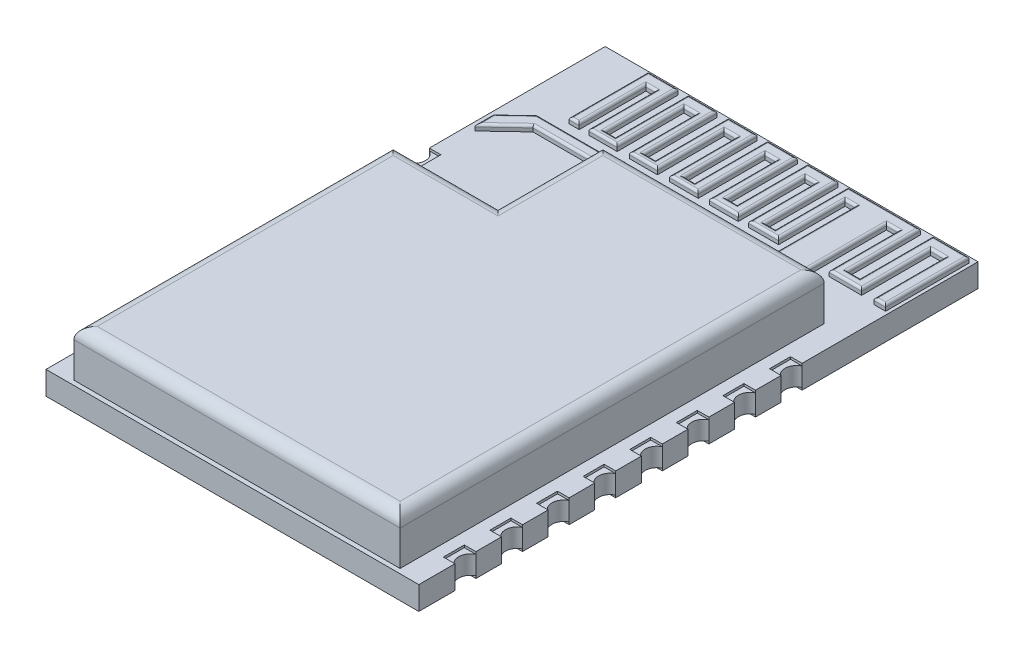
from build123d import *

# Parameters (mm, degrees)
EXTRUDE_1_DEPTH     = 1
CUT_EXTRUDE_1_DEPTH = 0.1
SKETCH_3_W          = 0.9999999999999991
SKETCH_3_H          = 0.9000000000000012
SKETCH_3_H_2        = 0.9000000000000021
SKETCH_3_W_2        = 1.0000000000000009
SKETCH_3_H_3        = 0.9000000000000017
SKETCH_3_H_4        = 0.9000000000000015
CUT_EXTRUDE_2_DEPTH = 0.1
CUT_EXTRUDE_3_DEPTH = 0.1
SKETCH_12_R         = 0.2
SKETCH_12_R_2       = 0.20000000000000023
SKETCH_12_R_3       = 0.1999999999999999
SKETCH_12_R_4       = 0.2000000000000001
SKETCH_12_R_5       = 0.19999999999999996
SKETCH_12_R_6       = 0.20000000000000007
CUT_EXTRUDE_4_DEPTH = 0.1
SKETCH_13_W         = 4.700000000000001
SKETCH_13_H         = 4.7
EXTRUDE_2_DEPTH     = 0.5
CUT_EXTRUDE_5_DEPTH = 0.1
SKETCH_16_R         = 0.2
SKETCH_16_R_2       = 0.19999999999999982
SKETCH_16_R_3       = 0.20000000000000004
SKETCH_16_R_4       = 0.19999999999999998
CUT_EXTRUDE_6_DEPTH = 0.25
EXTRUDE_4_DEPTH     = 2
CUT_EXTRUDE_7_DEPTH = 2
SKETCH_19_W         = 14
SKETCH_19_H         = 1.002469933908639
EXTRUDE_5_DEPTH     = 2
EXTRUDE_7_DEPTH     = 0.25
FILLET_4_R          = 0.1
FILLET_5_R          = 0.5


with BuildPart() as part:
    # 草圖1 → 填料-伸長1 (new body)
    with BuildSketch(Plane(origin=(0, 0, 0), x_dir=(1, 0, 0), z_dir=(0, 1, 0))):
        Polygon((-8, 12.000000000000002), (8, 12.000000000000002), (8.000000000000004, -11.999999999999998), (-7.9999999999999964, -11.999999999999998), align=None)
    extrude(amount=EXTRUDE_1_DEPTH)

    # 草圖2 → 除料-伸長1 (cut)
    with BuildSketch(Plane(origin=(0, 1, 0), x_dir=(1, 0, 0), z_dir=(0, 1, 0))):
        Polygon((-7.999999999999998, 2.4499977713717627), (-7.999999999999998, 1.5499977713717676), (-7.502985717330638, 1.5499977713717659), (-7.502985717330638, 2.449997771371764), align=None)
        Polygon((-7.999999999999998, 0.44999777137176267), (-7.999999999999998, -0.45000222862823236), (-7.502985717330638, -0.4500022286282341), (-7.502985717330638, 0.44999777137176394), align=None)
        Polygon((-7.999999999999998, -1.5500022286282373), (-7.999999999999998, -2.4500022286282324), (-7.502985717330637, -2.450002228628234), (-7.502985717330637, -1.550002228628236), align=None)
        Polygon((-7.999999999999997, -3.5500022286282373), (-7.999999999999997, -4.450002228628234), (-7.502985717330637, -4.450002228628234), (-7.502985717330637, -3.550002228628236), align=None)
        Polygon((-7.999999999999997, -5.550002228628239), (-7.999999999999997, -6.450002228628234), (-7.502985717330637, -6.450002228628234), (-7.502985717330637, -5.5500022286282364), align=None)
        Polygon((-7.999999999999997, -7.550002228628239), (-7.999999999999997, -8.450002228628234), (-7.5029857173306365, -8.450002228628234), (-7.5029857173306365, -7.5500022286282364), align=None)
        Polygon((-7.5029857173306365, -9.550002228628236), (-7.9999999999999964, -9.550002228628237), (-7.9999999999999964, -10.450002228628234), (-7.5029857173306365, -10.450002228628234), align=None)
        Polygon((7.5029857173306365, -10.450002228628234), (8.000000000000004, -10.450002228628232), (8.000000000000004, -9.550002228628237), (7.5029857173306365, -9.550002228628236), align=None)
        Polygon((7.5029857173306365, -8.450002228628234), (8.000000000000004, -8.450002228628232), (8.000000000000004, -7.550002228628238), (7.5029857173306365, -7.5500022286282364), align=None)
        Polygon((7.502985717330636, -6.450002228628234), (8.000000000000004, -6.450002228628232), (8.000000000000002, -5.550002228628238), (7.502985717330636, -5.5500022286282364), align=None)
        Polygon((7.502985717330636, -4.450002228628234), (8.000000000000002, -4.450002228628232), (8.000000000000002, -3.5500022286282373), (7.502985717330636, -3.550002228628236), align=None)
        Polygon((7.502985717330636, -2.450002228628234), (8.000000000000002, -2.4500022286282324), (8.000000000000002, -1.5500022286282373), (7.502985717330636, -1.550002228628236), align=None)
        Polygon((7.502985717330635, -0.4500022286282341), (8.000000000000002, -0.45000222862823236), (8.000000000000002, 0.44999777137176267), (7.502985717330635, 0.44999777137176394), align=None)
        Polygon((7.502985717330635, 3.549997771371766), (8.000000000000002, 3.5499977713717676), (8.000000000000002, 4.449997771371764), (7.502985717330635, 4.449997771371764), align=None)
        Polygon((7.502985717330635, 1.5499977713717659), (8.000000000000002, 1.5499977713717676), (8.000000000000002, 2.4499977713717627), (7.502985717330635, 2.449997771371764), align=None)
        Polygon((-7.502985717330638, 4.449997771371764), (-7.502985717330638, 3.549997771371766), (-8.002985717330638, 3.5499977713717676), (-8.002985717330638, 4.449997771371763), align=None)
    extrude(amount=-CUT_EXTRUDE_1_DEPTH, mode=Mode.SUBTRACT)

    # 草圖3 → 除料-伸長2 (cut)
    with BuildSketch(Plane.XZ):
        with Locations((7.5000000000000036, 7.999999999999998)):
            Rectangle(SKETCH_3_W, SKETCH_3_H)
        with Locations((7.5000000000000036, 9.999999999999998)):
            Rectangle(SKETCH_3_W, SKETCH_3_H_2)
        with Locations((7.5000000000000036, 5.999999999999998)):
            Rectangle(SKETCH_3_W_2, SKETCH_3_H)
        with Locations((7.5000000000000036, 3.9999999999999982)):
            Rectangle(SKETCH_3_W_2, SKETCH_3_H_3)
        with Locations((7.500000000000002, 1.9999999999999982)):
            Rectangle(SKETCH_3_W, SKETCH_3_H)
        with Locations((7.500000000000002, -1.75e-15)):
            Rectangle(SKETCH_3_W, SKETCH_3_H_4)
        with Locations((7.500000000000002, -2.0000000000000018)):
            Rectangle(SKETCH_3_W, SKETCH_3_H)
        with Locations((7.500000000000002, -4.000000000000002)):
            Rectangle(SKETCH_3_W, SKETCH_3_H_2)
        with Locations((-7.5000000000000036, 9.999999999999998)):
            Rectangle(SKETCH_3_W, SKETCH_3_H_2)
        with Locations((-7.500000000000002, -4.000000000000002)):
            Rectangle(SKETCH_3_W, SKETCH_3_H_2)
        with Locations((-7.500000000000002, -2.0000000000000018)):
            Rectangle(SKETCH_3_W, SKETCH_3_H)
        with Locations((-7.500000000000002, -1.75e-15)):
            Rectangle(SKETCH_3_W, SKETCH_3_H_4)
        with Locations((-7.500000000000002, 1.9999999999999982)):
            Rectangle(SKETCH_3_W, SKETCH_3_H)
        with Locations((-7.5000000000000036, 3.9999999999999982)):
            Rectangle(SKETCH_3_W_2, SKETCH_3_H_3)
        with Locations((-7.5000000000000036, 5.999999999999998)):
            Rectangle(SKETCH_3_W_2, SKETCH_3_H)
        with Locations((-7.5000000000000036, 7.999999999999998)):
            Rectangle(SKETCH_3_W, SKETCH_3_H)
    extrude(amount=-CUT_EXTRUDE_2_DEPTH, mode=Mode.SUBTRACT)

    # 草圖8 → 除料-伸長3 (cut)
    with BuildSketch(Plane(origin=(0, 1, 0), x_dir=(1, 0, 0), z_dir=(0, 1, 0))):
        Polygon((-0.9999999999999989, 0.6000000000000024), (3.7000000000000015, 0.6000000000000024), (3.700000000000002, -4.099999999999998), (-0.9999999999999983, -4.099999999999998), align=None)
    extrude(amount=-CUT_EXTRUDE_3_DEPTH, mode=Mode.SUBTRACT)

    # 草圖12 → 除料-伸長4 (cut)
    with BuildSketch(Plane(origin=(0, 0.9, 0), x_dir=(1, 0, 0), z_dir=(0, 1, 0))):
        with Locations(Location((-0.5099999999999989, -3.6499999999999977, 0), (0, 0, 270))):
            Circle(SKETCH_12_R)
        with Locations(Location((0.4200000000000011, -3.6499999999999977, 0), (0, 0, 270))):
            Circle(SKETCH_12_R)
        with Locations(Location((1.3500000000000012, -3.6499999999999977, 0), (0, 0, 270))):
            Circle(SKETCH_12_R)
        with Locations(Location((2.2800000000000007, -3.6499999999999977, 0), (0, 0, 270))):
            Circle(SKETCH_12_R_2)
        with Locations(Location((3.210000000000001, -3.6499999999999977, 0), (0, 0, 270))):
            Circle(SKETCH_12_R_2)
        with Locations(Location((-0.509999999999999, -2.7199999999999975, 0), (0, 0, 270))):
            Circle(SKETCH_12_R_3)
        with Locations(Location((0.420000000000001, -2.7199999999999975, 0), (0, 0, 270))):
            Circle(SKETCH_12_R_3)
        with Locations(Location((1.350000000000001, -2.7199999999999975, 0), (0, 0, 270))):
            Circle(SKETCH_12_R_3)
        with Locations(Location((2.2800000000000007, -2.7199999999999975, 0), (0, 0, 270))):
            Circle(SKETCH_12_R_4)
        with Locations(Location((3.210000000000001, -2.7199999999999975, 0), (0, 0, 270))):
            Circle(SKETCH_12_R_4)
        with Locations(Location((-0.5099999999999991, -1.7899999999999978, 0), (0, 0, 270))):
            Circle(SKETCH_12_R_5)
        with Locations(Location((0.4200000000000008, -1.7899999999999978, 0), (0, 0, 270))):
            Circle(SKETCH_12_R_6)
        with Locations(Location((1.350000000000001, -1.7899999999999978, 0), (0, 0, 270))):
            Circle(SKETCH_12_R)
        with Locations(Location((2.2800000000000002, -1.7899999999999978, 0), (0, 0, 270))):
            Circle(SKETCH_12_R_2)
        with Locations(Location((3.2100000000000004, -1.7899999999999978, 0), (0, 0, 270))):
            Circle(SKETCH_12_R_2)
        with Locations(Location((-0.5099999999999993, -0.8599999999999979, 0), (0, 0, 270))):
            Circle(SKETCH_12_R_6)
        with Locations(Location((0.4200000000000007, -0.8599999999999979, 0), (0, 0, 270))):
            Circle(SKETCH_12_R_5)
        with Locations(Location((1.3500000000000008, -0.8599999999999979, 0), (0, 0, 270))):
            Circle(SKETCH_12_R)
        with Locations(Location((2.2800000000000002, -0.8599999999999979, 0), (0, 0, 270))):
            Circle(SKETCH_12_R_2)
        with Locations(Location((3.2100000000000004, -0.8599999999999979, 0), (0, 0, 270))):
            Circle(SKETCH_12_R_2)
        with Locations(Location((-0.5099999999999995, 0.07000000000000235, 0), (0, 0, 270))):
            Circle(SKETCH_12_R_6)
        with Locations(Location((0.4200000000000006, 0.07000000000000235, 0), (0, 0, 270))):
            Circle(SKETCH_12_R_5)
        with Locations(Location((1.3500000000000008, 0.07000000000000235, 0), (0, 0, 270))):
            Circle(SKETCH_12_R)
        with Locations(Location((2.2800000000000002, 0.07000000000000235, 0), (0, 0, 270))):
            Circle(SKETCH_12_R_2)
        with Locations(Location((3.2100000000000004, 0.07000000000000235, 0), (0, 0, 270))):
            Circle(SKETCH_12_R_2)
    extrude(amount=-CUT_EXTRUDE_4_DEPTH, mode=Mode.SUBTRACT)

    # 草圖13 → 填料-伸長2 (add)
    with BuildSketch(Plane(origin=(0, 1, 0), x_dir=(1, 0, 0), z_dir=(0, 1, 0))):
        with Locations((1.3500000000000016, -1.7499999999999978)):
            Rectangle(SKETCH_13_W, SKETCH_13_H)
    extrude(amount=-EXTRUDE_2_DEPTH)

    # 草圖15 → 除料-伸長5 (cut)
    with BuildSketch(Plane.XZ):
        Polygon((1.0000000000000018, -0.6000000000000014), (-3.6999999999999984, -0.6000000000000021), (-3.6999999999999984, 4.099999999999997), (1.000000000000002, 4.099999999999998), align=None)
    extrude(amount=-CUT_EXTRUDE_5_DEPTH, mode=Mode.SUBTRACT)

    # 草圖16 → 除料-伸長6 (cut)
    with BuildSketch(Plane.XZ):
        with Locations(Location((0.5100000000000018, 3.6099999999999977, 0), (0, 0, 270))):
            Circle(SKETCH_16_R)
        with Locations(Location((-0.41999999999999826, 3.6099999999999977, 0), (0, 0, 270))):
            Circle(SKETCH_16_R)
        with Locations(Location((-1.3499999999999983, 3.609999999999997, 0), (0, 0, 270))):
            Circle(SKETCH_16_R)
        with Locations(Location((-2.279999999999998, 3.609999999999997, 0), (0, 0, 270))):
            Circle(SKETCH_16_R_2)
        with Locations(Location((-3.2099999999999986, 3.6099999999999968, 0), (0, 0, 270))):
            Circle(SKETCH_16_R_2)
        with Locations(Location((-3.2099999999999986, 2.679999999999997, 0), (0, 0, 270))):
            Circle(SKETCH_16_R_2)
        with Locations(Location((-2.279999999999998, 2.6799999999999975, 0), (0, 0, 270))):
            Circle(SKETCH_16_R_2)
        with Locations(Location((-1.3499999999999983, 2.6799999999999975, 0), (0, 0, 270))):
            Circle(SKETCH_16_R)
        with Locations(Location((-0.4199999999999983, 2.679999999999998, 0), (0, 0, 270))):
            Circle(SKETCH_16_R)
        with Locations(Location((0.5100000000000018, 2.679999999999998, 0), (0, 0, 270))):
            Circle(SKETCH_16_R)
        with Locations(Location((-3.2099999999999986, 1.749999999999997, 0), (0, 0, 270))):
            Circle(SKETCH_16_R_2)
        with Locations(Location((-2.279999999999998, 1.7499999999999973, 0), (0, 0, 270))):
            Circle(SKETCH_16_R_2)
        with Locations(Location((-1.3499999999999983, 1.7499999999999973, 0), (0, 0, 270))):
            Circle(SKETCH_16_R)
        with Locations(Location((-0.4199999999999984, 1.7499999999999978, 0), (0, 0, 270))):
            Circle(SKETCH_16_R_3)
        with Locations(Location((0.5100000000000017, 1.7499999999999978, 0), (0, 0, 270))):
            Circle(SKETCH_16_R)
        with Locations(Location((-3.2099999999999986, 0.819999999999997, 0), (0, 0, 270))):
            Circle(SKETCH_16_R_2)
        with Locations(Location((-2.279999999999998, 0.8199999999999974, 0), (0, 0, 270))):
            Circle(SKETCH_16_R_2)
        with Locations(Location((-1.3499999999999985, 0.8199999999999974, 0), (0, 0, 270))):
            Circle(SKETCH_16_R)
        with Locations(Location((-0.4199999999999984, 0.8199999999999978, 0), (0, 0, 270))):
            Circle(SKETCH_16_R_4)
        with Locations(Location((0.5100000000000017, 0.8199999999999978, 0), (0, 0, 270))):
            Circle(SKETCH_16_R)
        with Locations(Location((-3.2099999999999986, -0.11000000000000289, 0), (0, 0, 270))):
            Circle(SKETCH_16_R_2)
        with Locations(Location((-2.279999999999998, -0.11000000000000246, 0), (0, 0, 270))):
            Circle(SKETCH_16_R_2)
        with Locations(Location((-1.3499999999999985, -0.11000000000000246, 0), (0, 0, 270))):
            Circle(SKETCH_16_R)
        with Locations(Location((-0.41999999999999843, -0.11000000000000203, 0), (0, 0, 270))):
            Circle(SKETCH_16_R)
        with Locations(Location((0.5100000000000016, -0.11000000000000203, 0), (0, 0, 270))):
            Circle(SKETCH_16_R)
    extrude(amount=-CUT_EXTRUDE_6_DEPTH, mode=Mode.SUBTRACT)

    # 草圖17 → 填料-伸長4 (add)
    with BuildSketch(Plane(origin=(0, 1, 0), x_dir=(1, 0, 0), z_dir=(0, 1, 0))):
        Polygon((-2.500000000000001, 6.400000000000003), (7.000000000000003, 6.400000000000002), (7.000000000000003, -10.799999999999999), (-6.999999999999997, -10.799999999999999), (-6.999999999999999, 1.400000000000001), (-6.999999999999999, 1.9000000000000024), (-2.5000000000000004, 1.9000000000000032), align=None)
    extrude(amount=EXTRUDE_4_DEPTH)

    # 草圖18 → 除料-伸長7 (cut)
    with BuildSketch(Plane(origin=(0, 1, 0), x_dir=(1, 0, 0), z_dir=(0, 1, 0))):
        with BuildLine():
            Line((-8, 4.449997771371763), (-7.999999999999998, 3.549997771371766))
            ThreePointArc((-7.999999999999998, 3.549997771371766), (-7.717944947177037, 3.999997771371765), (-8, 4.449997771371763))
        make_face()
        with BuildLine():
            Line((-8, 2.4499977713717622), (-7.999999999999998, 1.5499977713717659))
            ThreePointArc((-7.999999999999998, 1.5499977713717659), (-7.717944947177038, 1.999997771371765), (-8, 2.4499977713717622))
        make_face()
        with BuildLine():
            Line((-8, 0.4499977713717622), (-7.999999999999998, -0.4500022286282341))
            ThreePointArc((-7.999999999999998, -0.4500022286282341), (-7.717944947177038, -2.22862823506e-06), (-8, 0.4499977713717622))
        make_face()
        with BuildLine():
            Line((-8, -1.5500022286282378), (-7.999999999999998, -2.450002228628234))
            ThreePointArc((-7.999999999999998, -2.450002228628234), (-7.717944947177037, -2.0000022286282353), (-8, -1.5500022286282378))
        make_face()
        with BuildLine():
            Line((-8, -3.5500022286282378), (-7.999999999999998, -4.450002228628234))
            ThreePointArc((-7.999999999999998, -4.450002228628234), (-7.717944947177038, -4.000002228628235), (-8, -3.5500022286282378))
        make_face()
        with BuildLine():
            Line((-8, -5.550002228628238), (-7.999999999999998, -6.450002228628234))
            ThreePointArc((-7.999999999999998, -6.450002228628234), (-7.717944947177038, -6.000002228628235), (-8, -5.550002228628238))
        make_face()
        with BuildLine():
            Line((-8, -7.550002228628238), (-7.999999999999998, -8.450002228628234))
            ThreePointArc((-7.999999999999998, -8.450002228628234), (-7.717944947177037, -8.000002228628235), (-8, -7.550002228628238))
        make_face()
        with BuildLine():
            Line((-8, -9.550002228628237), (-7.999999999999998, -10.450002228628234))
            ThreePointArc((-7.999999999999998, -10.450002228628234), (-7.717944947177038, -10.000002228628235), (-8, -9.550002228628237))
        make_face()
        with BuildLine():
            Line((8, 4.449997771371763), (7.999999999999998, 3.549997771371766))
            ThreePointArc((7.999999999999998, 3.549997771371766), (7.717944947177037, 3.999997771371765), (8, 4.449997771371763))
        make_face()
        with BuildLine():
            Line((8, 2.4499977713717622), (7.999999999999998, 1.5499977713717659))
            ThreePointArc((7.999999999999998, 1.5499977713717659), (7.717944947177038, 1.999997771371765), (8, 2.4499977713717622))
        make_face()
        with BuildLine():
            Line((8, 0.4499977713717622), (7.999999999999998, -0.4500022286282341))
            ThreePointArc((7.999999999999998, -0.4500022286282341), (7.717944947177038, -2.228628235e-06), (8, 0.4499977713717622))
        make_face()
        with BuildLine():
            Line((8, -1.5500022286282378), (7.999999999999998, -2.450002228628234))
            ThreePointArc((7.999999999999998, -2.450002228628234), (7.717944947177037, -2.0000022286282353), (8, -1.5500022286282378))
        make_face()
        with BuildLine():
            Line((8, -3.5500022286282378), (7.999999999999998, -4.450002228628234))
            ThreePointArc((7.999999999999998, -4.450002228628234), (7.717944947177038, -4.000002228628235), (8, -3.5500022286282378))
        make_face()
        with BuildLine():
            Line((8, -5.550002228628238), (7.999999999999998, -6.450002228628234))
            ThreePointArc((7.999999999999998, -6.450002228628234), (7.717944947177038, -6.000002228628235), (8, -5.550002228628238))
        make_face()
        with BuildLine():
            Line((8, -7.550002228628238), (7.999999999999998, -8.450002228628234))
            ThreePointArc((7.999999999999998, -8.450002228628234), (7.717944947177037, -8.000002228628235), (8, -7.550002228628238))
        make_face()
        with BuildLine():
            Line((8, -9.550002228628237), (7.999999999999998, -10.450002228628234))
            ThreePointArc((7.999999999999998, -10.450002228628234), (7.717944947177038, -10.000002228628235), (8, -9.550002228628237))
        make_face()
    extrude(amount=-CUT_EXTRUDE_7_DEPTH, mode=Mode.SUBTRACT)

    # 草圖19 → 填料-伸長5 (add)
    with BuildSketch(Plane(origin=(0, 1, 0), x_dir=(1, 0, 0), z_dir=(0, 1, 0))):
        with Locations((2.22e-15, -11.301234966954318)):
            Rectangle(SKETCH_19_W, SKETCH_19_H)
    extrude(amount=EXTRUDE_5_DEPTH)

    # 草圖20 → 填料-伸長7 (add)
    with BuildSketch(Plane(origin=(0, 1, 0), x_dir=(1, 0, 0), z_dir=(0, 1, 0))):
        Polygon((2.7745772280204366, 7.299411594104662), (2.774577228020436, 6.400000000000003), (2.2500000000000013, 6.400000000000003), (2.2333276157297033, 7.273314493037537), (-6.374311063944464, 7.2733144930375415), (-7.5709253757125925, 6.142787441828224), (-7.65515008486728, 6.06321434033413), (-7.65515008486728, 6.074907724951117), (-7.65515008486728, 6.142787441828224), (-7.65515008486728, 6.849705797052333), (-6.687394800885329, 7.764013370288473), (3.5229671278681067, 7.7640133702884695), (3.5229671278681067, 11.214195737954471), (3.088020932820037, 11.214195737954471), (3.088020932820037, 8.351190733603364), (1.8049296574282336, 8.351190733603364), (1.8049296574282336, 11.214195737954471), (1.359109807503962, 11.214195737954471), (1.359109807503962, 8.351190733603364), (0.11951315161696369, 8.351190733603364), (0.11951315161696369, 11.214195737954471), (-0.35892766293591294, 11.214195737954471), (-0.35892766293591294, 8.351190733603364), (-1.5876506639467096, 8.351190733603364), (-1.5876506639467096, 11.214195737954471), (-2.109586098004393, 11.214195737954471), (-2.109586098004393, 8.351190733603364), (-3.3165617892627863, 8.351190733603364), (-3.3165617892627863, 11.214195737954471), (-3.8384972233204695, 11.214195737954471), (-3.8384972233204695, 8.351190733603364), (-5.056346569455065, 8.351190733603364), (-5.056346569455065, 11.214195737954471), (-5.4695454547507305, 11.214195737954471), (-5.4695454547507305, 8.351190733603364), (-5.904491649798801, 8.351190733603364), (-5.904491649798801, 11.75561570856587), (-4.632274029283196, 11.75561570856587), (-4.632274029283196, 8.628639143606161), (-4.185197948571669, 8.628639143606161), (-4.185197948571669, 11.75561570856587), (-2.9587159743295213, 11.75561570856587), (-2.9587159743295213, 8.628639143606161), (-2.4725429394947964, 8.628639143606161), (-2.4725429394947964, 11.75561570856587), (-1.235011578097315, 11.75561570856587), (-1.235011578097315, 8.628639143606161), (-0.7819867047285942, 8.628639143606161), (-0.7819867047285942, 11.75561570856587), (0.4886928181348912, 11.75561570856587), (0.4886928181348912, 8.728083628004175), (0.9417176915036121, 8.728083628004175), (0.9417176915036121, 11.75561570856587), (2.2344959886777684, 11.75561570856587), (2.2344959886777684, 8.628639143606161), (2.6764714748911547, 8.628639143606161), (2.6764714748911547, 11.75561570856587), (5.770299878384859, 11.75561570856587), (5.770299878384859, 8.628639143606161), (5.858694975627536, 8.628639143606161), (6.3117198489962565, 8.628639143606161), (6.3117198489962565, 11.75561570856587), (7.8586340507431105, 11.75561570856587), (7.8586340507431105, 8.17561427023744), (7.350362241597716, 8.17561427023744), (7.350362241597716, 11.214195737954471), (6.7536953352096445, 11.214195737954471), (6.7536953352096445, 8.252959980324784), (5.361472553637476, 8.252959980324784), (5.361472553637476, 11.214195737954471), (4.855655638179534, 11.214195737954471), (4.855655638179534, 7.299411594104662), align=None)
    extrude(amount=EXTRUDE_7_DEPTH)

    # 圓角4
    fillet_4_edges = [part.edges().sort_by_distance(p)[0] for p in [
        (-7.014730574405872, 1.25, -6.668264416685836),
        (2.2500000000000013, 1.125, -6.400000000000003),
        (2.7745772280204366, 1.25, -6.849705797052332),
        (2.774577228020436, 1.125, -6.400000000000003),
        (3.5229671278681067, 1.25, -9.48910455412147),
        (-1.5822138365086111, 1.25, -7.764013370288471),
        (-7.171272442876305, 1.25, -7.306859583670403),
        (-7.65515008486728, 1.25, -6.456460068693231),
        (-2.0704917241073804, 1.25, -7.273314493037539),
        (2.2416638078648523, 1.25, -6.8366572465187705),
        (2.5122886140102185, 1.25, -6.400000000000003),
        (3.815116433099985, 1.25, -7.299411594104662),
        (4.855655638179534, 1.25, -9.256803666029565),
        (5.1085640959085055, 1.25, -11.214195737954471),
        (5.361472553637476, 1.25, -9.733577859139627),
        (6.057583944423561, 1.25, -8.252959980324784),
        (6.7536953352096445, 1.25, -9.733577859139627),
        (7.05202878840368, 1.25, -11.214195737954471),
        (7.350362241597716, 1.25, -9.694905004095956),
        (7.604498146170413, 1.25, -8.17561427023744),
        (7.8586340507431105, 1.25, -9.965614989401654),
        (7.085176949869684, 1.25, -11.75561570856587),
        (6.3117198489962565, 1.25, -10.192127426086016),
        (6.041009863690558, 1.25, -8.628639143606161),
        (5.770299878384859, 1.25, -10.192127426086016),
        (4.2233856766380065, 1.25, -11.75561570856587),
        (2.6764714748911547, 1.25, -10.192127426086016),
        (2.4554837317844616, 1.25, -8.628639143606161),
        (2.2344959886777684, 1.25, -10.192127426086016),
        (1.5881068400906901, 1.25, -11.75561570856587),
        (0.9417176915036121, 1.25, -10.241849668285022),
        (0.7152052548192516, 1.25, -8.728083628004175),
        (0.4886928181348912, 1.25, -10.241849668285022),
        (-0.14664694329685157, 1.25, -11.75561570856587),
        (-0.7819867047285942, 1.25, -10.192127426086016),
        (-1.0084991414129547, 1.25, -8.628639143606161),
        (-1.235011578097315, 1.25, -10.192127426086016),
        (-1.8537772587960557, 1.25, -11.75561570856587),
        (-2.4725429394947964, 1.25, -10.192127426086016),
        (-2.7156294569121586, 1.25, -8.628639143606161),
        (-2.9587159743295213, 1.25, -10.192127426086016),
        (-3.571956961450595, 1.25, -11.75561570856587),
        (-4.185197948571669, 1.25, -10.192127426086016),
        (-4.4087359889274325, 1.25, -8.628639143606161),
        (-4.632274029283196, 1.25, -10.192127426086016),
        (-5.268382839540998, 1.25, -11.75561570856587),
        (-5.904491649798801, 1.25, -10.053403221084617),
        (-5.687018552274766, 1.25, -8.351190733603364),
        (-5.4695454547507305, 1.25, -9.782693235778918),
        (-5.262946012102898, 1.25, -11.214195737954471),
        (-5.056346569455065, 1.25, -9.782693235778918),
        (-4.447421896387767, 1.25, -8.351190733603364),
        (-3.8384972233204695, 1.25, -9.782693235778918),
        (-3.577529506291628, 1.25, -11.214195737954471),
        (-3.3165617892627863, 1.25, -9.782693235778918),
        (-2.7130739436335896, 1.25, -8.351190733603364),
        (-2.109586098004393, 1.25, -9.782693235778918),
        (-1.8486183809755512, 1.25, -11.214195737954471),
        (-1.5876506639467096, 1.25, -9.782693235778918),
        (-0.9732891634413113, 1.25, -8.351190733603364),
        (-0.35892766293591294, 1.25, -9.782693235778918),
        (-0.11970725565947463, 1.25, -11.214195737954471),
        (0.11951315161696369, 1.25, -9.782693235778918),
        (0.7393114795604628, 1.25, -8.351190733603364),
        (1.359109807503962, 1.25, -9.782693235778918),
        (1.5820197324660978, 1.25, -11.214195737954471),
        (1.8049296574282336, 1.25, -9.782693235778918),
        (2.4464752951241353, 1.25, -8.351190733603364),
        (3.088020932820037, 1.25, -9.782693235778918),
        (3.3054940303440716, 1.25, -11.214195737954471),
    ]]
    fillet(fillet_4_edges, radius=FILLET_4_R)

    # 圓角5
    fillet_5_edges = [part.edges().sort_by_distance(p)[0] for p in [
        (7.000000000000003, 3, 2.701234966954317),
        (2.250000000000001, 3, -6.400000000000002),
        (-2.500000000000001, 3, -4.150000000000003),
        (-4.75, 3, -1.9000000000000028),
        (-6.999999999999998, 3, 4.951234966954317),
        (2.66e-15, 3, 11.802469933908636),
    ]]
    fillet(fillet_5_edges, radius=FILLET_5_R)


solid = part.part
